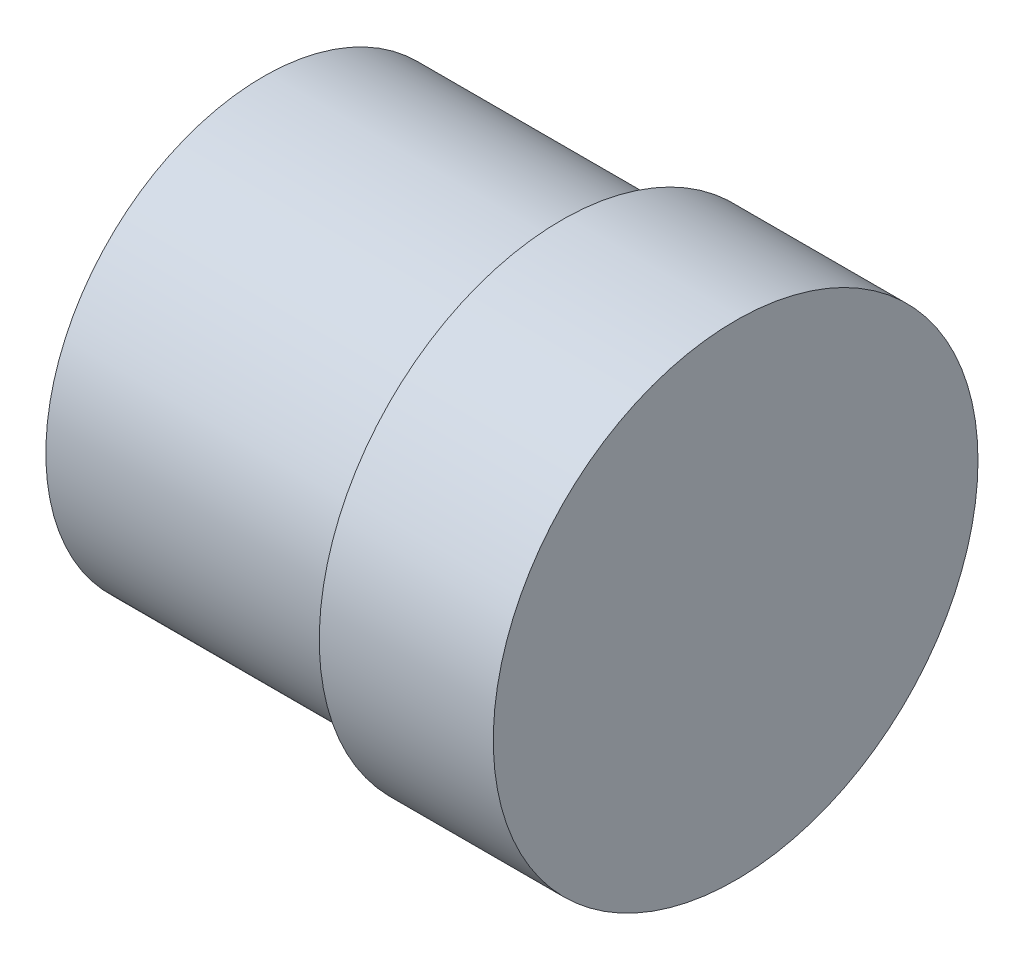
from build123d import *

# Parameters (mm, degrees)
SKETCH1_R           = 495.3
BOSS_EXTRUDE1_DEPTH = 355.6
SKETCH2_R           = 444.5
BOSS_EXTRUDE3_DEPTH = 609.6


with BuildPart() as part:
    # Sketch1 → Boss-Extrude1 (new body)
    with BuildSketch(Plane(origin=(0, 0, 0), x_dir=(0, 0, -1), z_dir=(1, 0, 0))):
        Circle(SKETCH1_R)
    extrude(amount=BOSS_EXTRUDE1_DEPTH)

    # Sketch2 → Boss-Extrude3 (add)
    with BuildSketch(Plane(origin=(0, 0, 0), x_dir=(0, 0, -1), z_dir=(1, 0, 0))):
        Circle(SKETCH2_R)
    extrude(amount=-BOSS_EXTRUDE3_DEPTH)


solid = part.part
